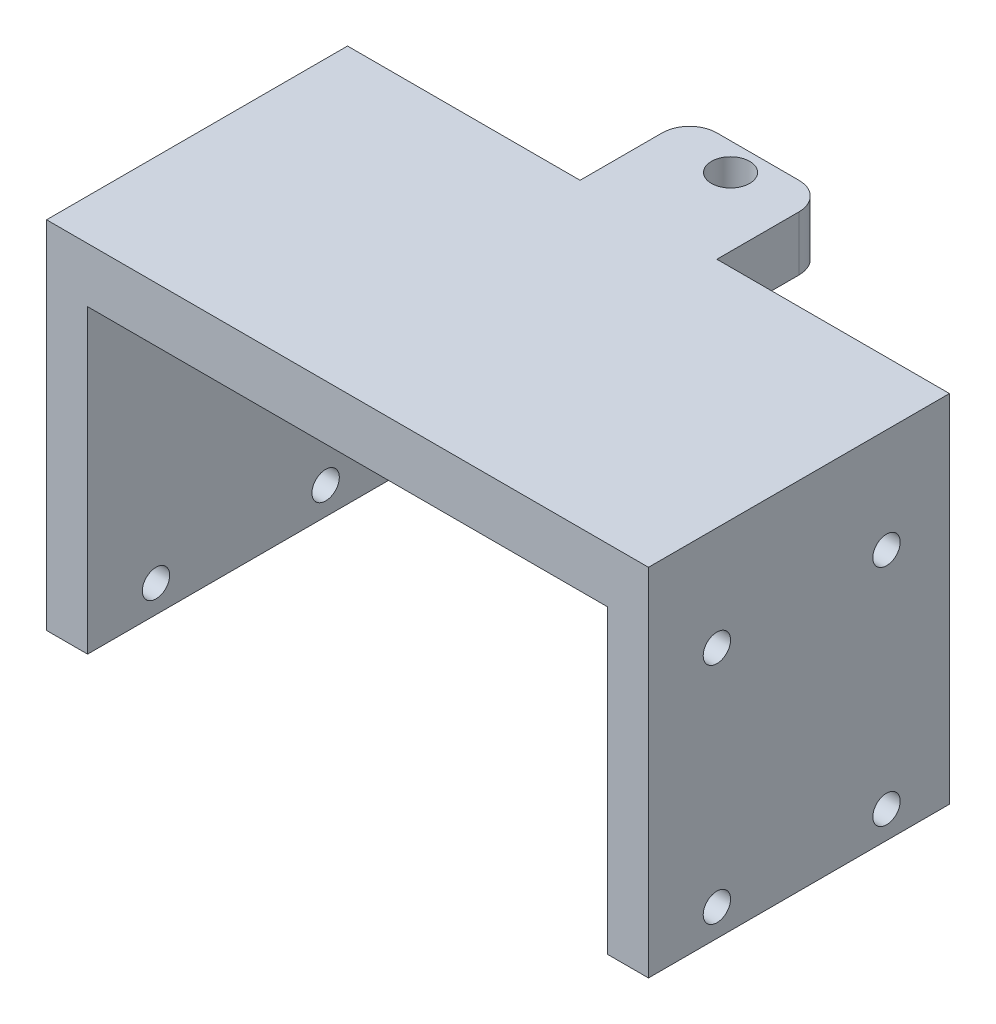
from build123d import *

# Parameters (mm, degrees)
SKETCH_1_W          = 220
SKETCH_1_H          = 130
EXTRUDE_1_DEPTH     = 110
SKETCH_2_W          = 190
SKETCH_2_H          = 110
CUT_EXTRUDE_1_DEPTH = 169.597153001
ST9_5_1_D           = 10
SKETCH_5_W          = 50
SKETCH_5_H          = 20
EXTRUDE_2_DEPTH     = 40
HOLE_WIZARD_M16_1_D = 14
FILLET_1_R          = 10


with BuildPart() as part:
    # 草图1 → 凸台-拉伸1 (new body)
    with BuildSketch(Plane.XY):
        Rectangle(SKETCH_1_W, SKETCH_1_H)
    extrude(amount=EXTRUDE_1_DEPTH)

    # 草图2 → 切除-拉伸1 (cut, through all)
    with BuildSketch(Plane.XY.offset(110)):
        with Locations((0, -10)):
            Rectangle(SKETCH_2_W, SKETCH_2_H)
    extrude(amount=-CUT_EXTRUDE_1_DEPTH, mode=Mode.SUBTRACT)

    # ST9.5 间隙孔1 (through all)
    with Locations(Plane.ZY.offset(110)):
        with Locations((23, 27), (85, 27), (85, -55), (23, -55)):
            Hole(ST9_5_1_D / 2)

    # 草图5 → 凸台-拉伸2 (add)
    with BuildSketch(Plane(origin=(0, 0, 0), x_dir=(-1, 0, 0), z_dir=(0, 0, -1))):
        with Locations((0, 55)):
            Rectangle(SKETCH_5_W, SKETCH_5_H)
    extrude(amount=EXTRUDE_2_DEPTH)

    # M16 螺纹孔1 (through all)
    with Locations(Plane(origin=(0, 65, 0), x_dir=(1, 0, 0), z_dir=(0, 1, 0))):
        with Locations((0, 30)):
            Hole(HOLE_WIZARD_M16_1_D / 2)

    # 圆角1
    fillet_1_edges = [part.edges().sort_by_distance(p)[0] for p in [
        (25, 55, -40),
        (-25, 55, -40),
    ]]
    fillet(fillet_1_edges, radius=FILLET_1_R)


solid = part.part
